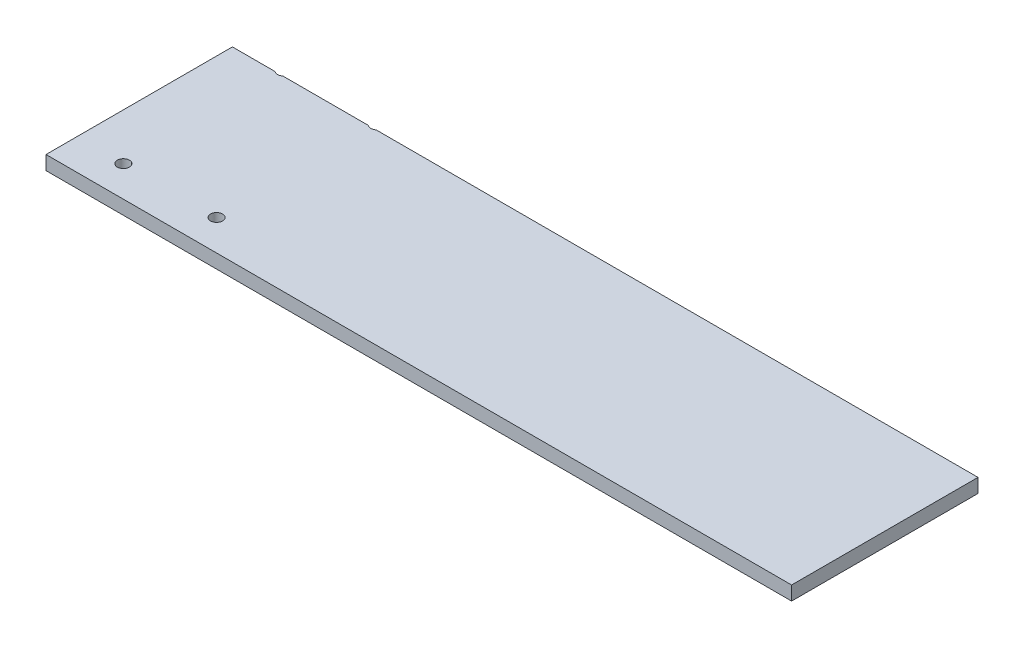
from build123d import *

# Parameters (mm, degrees)
SKETCH1_W           = 800
SKETCH1_H           = 200
BOSS_EXTRUDE1_DEPTH = 7.5
SKETCH2_R           = 6.5
CUT_EXTRUDE1_DEPTH  = 413.583324918


with BuildPart() as part:
    # Sketch1 → Boss-Extrude1 (new, symmetric)
    with BuildSketch(Plane(origin=(0, 0, 0), x_dir=(1, 0, 0), z_dir=(0, 1, 0))):
        Rectangle(SKETCH1_W, SKETCH1_H)
    extrude(amount=BOSS_EXTRUDE1_DEPTH, both=True)

    # Sketch2 → Cut-Extrude1 (cut, through all)
    with BuildSketch(Plane(origin=(0, 7.5, 0), x_dir=(1, 0, 0), z_dir=(0, 1, 0))):
        with Locations(Location((-350, -67, 0), (0, 0, 270))):
            Circle(SKETCH2_R)
        with Locations(Location((-250, -67, 0), (0, 0, 270))):
            Circle(SKETCH2_R)
        with Locations((-350, 105)):
            Circle(SKETCH2_R)
        with Locations((-250, 105)):
            Circle(SKETCH2_R)
    extrude(amount=-CUT_EXTRUDE1_DEPTH, mode=Mode.SUBTRACT)


solid = part.part
